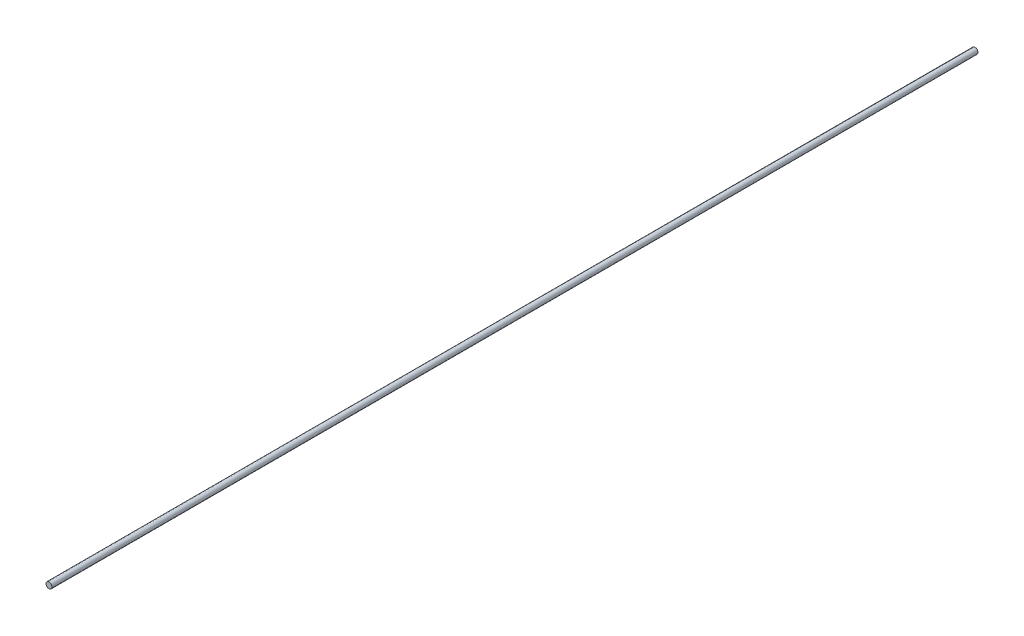
from build123d import *

# Parameters (mm, degrees)
SKETCH1_R           = 3.175
BOSS_EXTRUDE1_DEPTH = 990.6


with BuildPart() as part:
    # Sketch1 → Boss-Extrude1 (new body)
    with BuildSketch(Plane.XY):
        Circle(SKETCH1_R)
    extrude(amount=BOSS_EXTRUDE1_DEPTH)


solid = part.part
